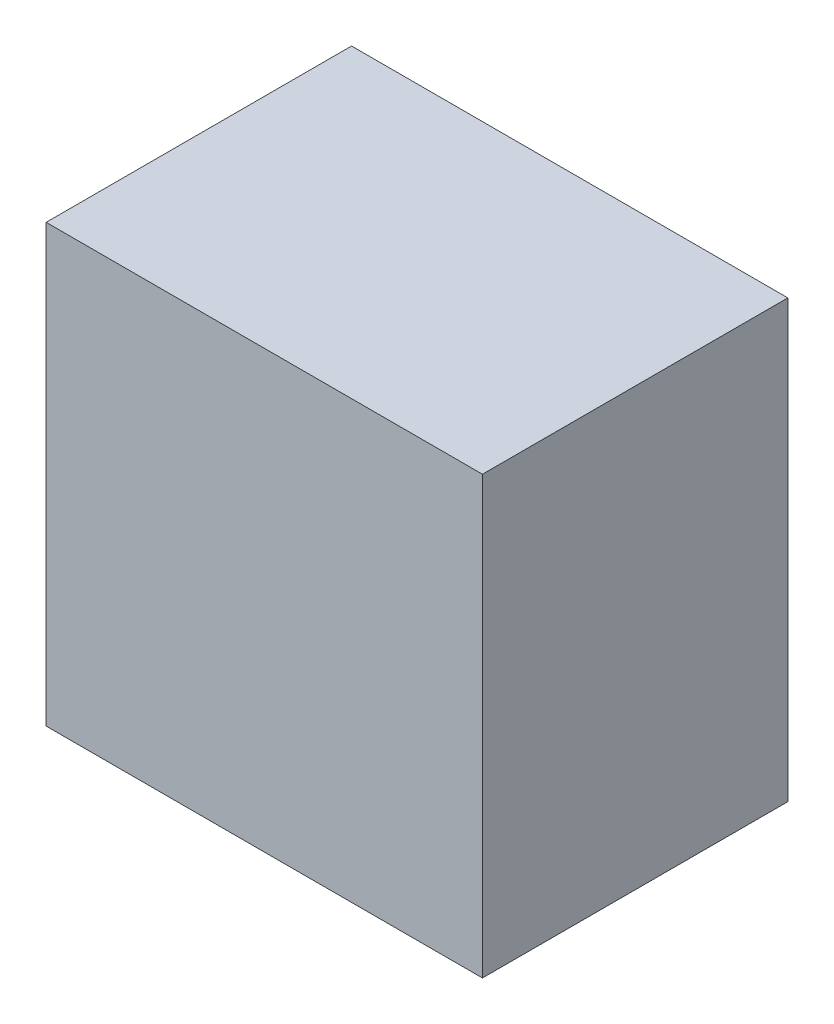
from build123d import *

# Parameters (mm, degrees)
SKETCH1_W           = 40
SKETCH1_H           = 40
BOSS_EXTRUDE1_DEPTH = 28


with BuildPart() as part:
    # Sketch1 → Boss-Extrude1 (new body)
    with BuildSketch(Plane.XY):
        Rectangle(SKETCH1_W, SKETCH1_H)
    extrude(amount=BOSS_EXTRUDE1_DEPTH)


solid = part.part
